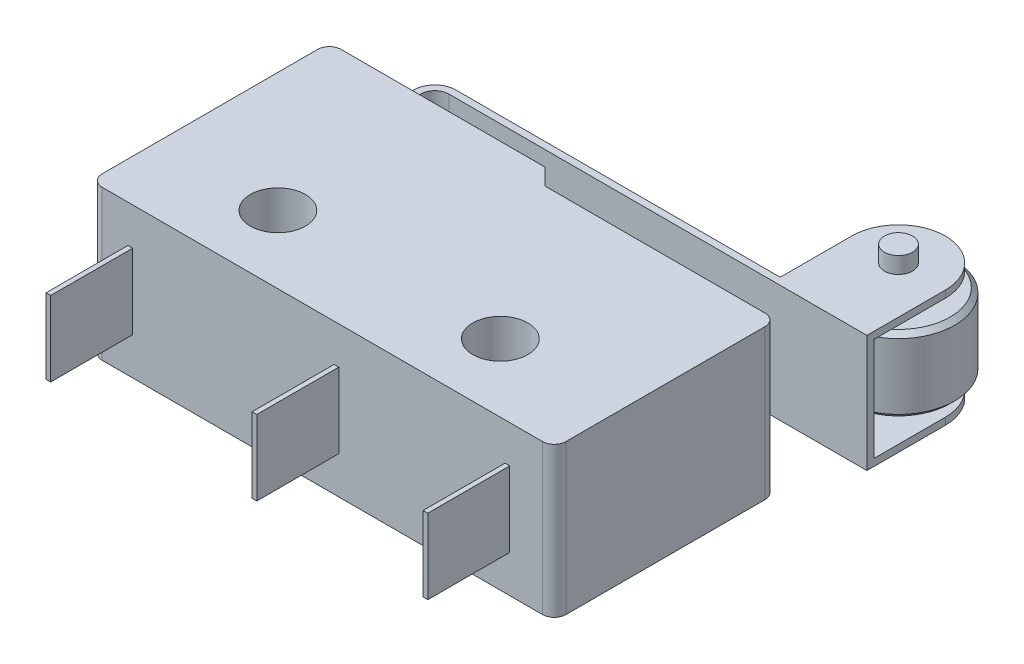
from build123d import *

# Parameters (mm, degrees)
EXTRUDE_1_DEPTH     = 3.2
CUT_EXTRUDE_1_REACH = 14.844
SKETCH_2_R          = 1.175
FILLET_1_R          = 0.5
EXTRUDE_1_2_DEPTH   = 2.5
EXTRUDE_2_DEPTH     = 0.3
EXTRUDE_3_REACH     = 19.807
SKETCH_5_R          = 0.6
SKETCH_6_R          = 2.4
EXTRUDE_4_DEPTH     = 1.6
CHAMFER_1_SIZE      = 0.2
SKETCH_7_W          = 0.2
SKETCH_7_H          = 3.5
EXTRUDE_2_2_DEPTH   = 1.6


with BuildPart() as part:
    # 草图1 → Extrude 1 (new, symmetric)
    with BuildSketch(Plane(origin=(0, 0, 0), x_dir=(1, 0, 0), z_dir=(0, 1, 0))):
        Polygon((9.9, 4.4), (0, 4.4), (-0.7, 5.1), (-9.9, 5.1), (-9.9, -5.1), (9.9, -5.1), align=None)
    extrude(amount=EXTRUDE_1_DEPTH, both=True)

    # 草图2 → 切除-拉伸1 (cut, up to next)
    with BuildSketch(Plane(origin=(0, 3.2, 0), x_dir=(1, 0, 0), z_dir=(0, 1, 0)), mode=Mode.PRIVATE) as cut_extrude_1_sk1:
        with Locations(Location((-4.8, -2.2, 0), (0, 0, 270))):
            Circle(SKETCH_2_R)
    cut_extrude_1_tool1 = extrude(cut_extrude_1_sk1.sketch, amount=-CUT_EXTRUDE_1_REACH, mode=Mode.PRIVATE) & part.part
    # 草图2 → 切除-拉伸1 (cut, up to next)
    with BuildSketch(Plane(origin=(0, 3.2, 0), x_dir=(1, 0, 0), z_dir=(0, 1, 0)), mode=Mode.PRIVATE) as cut_extrude_1_sk2:
        with Locations(Location((4.7, -2.2, 0), (0, 0, 270))):
            Circle(SKETCH_2_R)
    cut_extrude_1_tool2 = extrude(cut_extrude_1_sk2.sketch, amount=-CUT_EXTRUDE_1_REACH, mode=Mode.PRIVATE) & part.part
    add(cut_extrude_1_tool1.solids().sort_by_distance((-4.8, 3.2, 2.2))[0], mode=Mode.SUBTRACT)
    add(cut_extrude_1_tool2.solids().sort_by_distance((4.7, 3.2, 2.2))[0], mode=Mode.SUBTRACT)

    # 圆角1
    fillet_1_edges = [part.edges().sort_by_distance(p)[0] for p in [
        (9.9, 0, 5.1),
        (-9.9, 0, 5.1),
        (-9.9, 0, -5.1),
        (9.9, 0, -4.4),
    ]]
    fillet(fillet_1_edges, radius=FILLET_1_R)

    # 草图3 → Extrude 1 2 (add, symmetric)
    with BuildSketch(Plane(origin=(0, 0, 0), x_dir=(1, 0, 0), z_dir=(0, 1, 0))):
        with BuildLine():
            Line((-6.75, 5.1), (-6.75, 5.85))
            ThreePointArc((-6.75, 5.85), (-6.574264069, 6.274264069), (-6.15, 6.45))
            Line((-6.15, 6.45), (11.7, 6.45))
            Line((11.7, 6.45), (11.7, 6.75))
            Line((11.7, 6.75), (-6.15, 6.75))
            ThreePointArc((-6.15, 6.75), (-6.786396103, 6.486396103), (-7.05, 5.85))
            Line((-7.05, 5.85), (-7.05, 5.1))
            Line((-7.05, 5.1), (-6.75, 5.1))
        make_face()
    extrude(amount=EXTRUDE_1_2_DEPTH, both=True)

    # 草图4 → Extrude 2 (add)
    with BuildSketch(Plane(origin=(0, 2.5, 0), x_dir=(1, 0, 0), z_dir=(0, 1, 0))):
        with BuildLine():
            Line((7.7, 9.8), (7.7, 6.45))
            Line((7.7, 6.45), (11.7, 6.45))
            Line((11.7, 6.45), (11.7, 9.8))
            ThreePointArc((11.7, 9.8), (9.7, 11.8), (7.7, 9.8))
        make_face()
    extrude_2 = extrude(amount=-EXTRUDE_2_DEPTH)

    # 镜向1: Extrude 2 across plane
    add(extrude_2.mirror(Plane.ZX))

    # 凸台-拉伸3: up to this face of the body (flat: up to its plane)
    extrude_3_end = Plane(part.part.faces().sort_by_distance((-0.181890176, -3.2, 0.080625265))[0])
    # 草图5 → 凸台-拉伸3 (add, up to the picked face)
    with BuildSketch(Plane(origin=(0, 3.2, 0), x_dir=(1, 0, 0), z_dir=(0, 1, 0)), mode=Mode.PRIVATE) as extrude_3_sk1:
        with Locations(Location((9.7, 9.8, 0), (0, 0, 270))):
            Circle(SKETCH_5_R)
    extrude_3_tool1 = split(extrude(extrude_3_sk1.sketch, amount=-EXTRUDE_3_REACH, mode=Mode.PRIVATE), bisect_by=extrude_3_end, keep=Keep.BOTH, mode=Mode.PRIVATE)
    add(extrude_3_tool1.solids().sort_by(Axis((9.7, 3.2, -9.8), (0, -1, 0)))[0])

    # 草图6 → 凸台-拉伸4 (add, symmetric)
    with BuildSketch(Plane(origin=(0, 0, 0), x_dir=(1, 0, 0), z_dir=(0, 1, 0))):
        with Locations(Location((9.7, 9.8, 0), (0, 0, 270))):
            Circle(SKETCH_6_R)
    extrude(amount=EXTRUDE_4_DEPTH, both=True)

    # 倒角1
    chamfer_1_edges = [part.edges().sort_by_distance(p)[0] for p in [
        (9.7, -1.6, -12.2),
        (9.7, 1.6, -12.2),
    ]]
    chamfer(chamfer_1_edges, length=CHAMFER_1_SIZE)

    # 草图7 → Extrude 2 2 (add, symmetric)
    with BuildSketch(Plane(origin=(0, 0, 0), x_dir=(1, 0, 0), z_dir=(0, 1, 0))):
        with Locations((-8.2, -6.85)):
            Rectangle(SKETCH_7_W, SKETCH_7_H)
        with Locations((0.6, -6.85)):
            Rectangle(SKETCH_7_W, SKETCH_7_H)
        with Locations((7.9, -6.85)):
            Rectangle(SKETCH_7_W, SKETCH_7_H)
    extrude(amount=EXTRUDE_2_2_DEPTH, both=True)


solid = part.part
